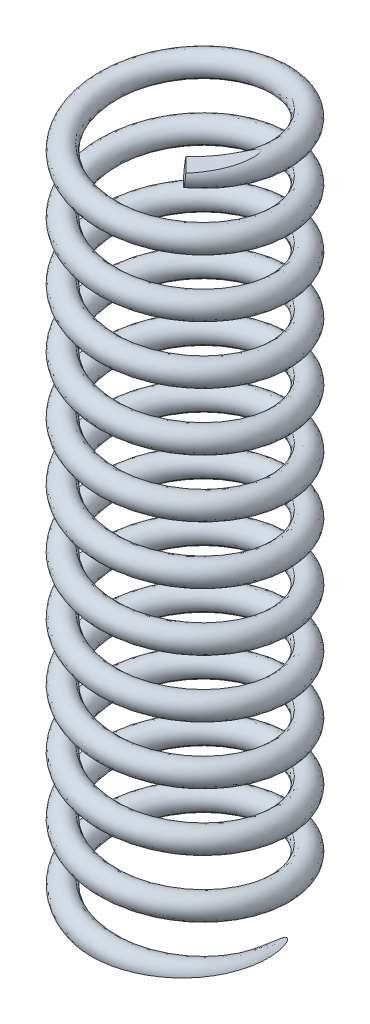
from build123d import *

# Parameters (mm, degrees)
WYCI_GNI_CIE_PO_CIE_CE1_PITCH       = 20
WYCI_GNI_CIE_PO_CIE_CE1_HEIGHT      = 330
WYCI_GNI_CIE_PO_CIE_CE1_RADIUS      = 30
WYCI_GNI_CIE_PO_CIE_CE1_START_ANGLE = -135
SZKIC3_R                            = 4
WYTNIJ_WYCI_GNI_CIE1_DEPTH          = 40
WYTNIJ_WYCI_GNI_CIE1_DEPTH_BACK     = 40
SZKIC4_W                            = 119.333488775
SZKIC4_H                            = 29.635807342
SZKIC4_W_2                          = 156.068337871
SZKIC4_H_2                          = 99.910466123


with BuildPart() as part:
    # Wyciągnięcie po ścieżce1: sweep along a helix
    with BuildLine() as wyci_gni_cie_po_cie_ce1_path:
        add(Helix(WYCI_GNI_CIE_PO_CIE_CE1_PITCH, WYCI_GNI_CIE_PO_CIE_CE1_HEIGHT, WYCI_GNI_CIE_PO_CIE_CE1_RADIUS, center=(0, 0, 0), direction=(0, 1, 0), lefthand=True, mode=Mode.PRIVATE).rotate(Axis((0, 0, 0), (0, 1, 0)), WYCI_GNI_CIE_PO_CIE_CE1_START_ANGLE))
    # Szkic3 → Wyciągnięcie po ścieżce1 (sweep)
    with BuildSketch(Plane(origin=(-21.213203436, 0, -21.213203436), x_dir=(-0.711031848696283, 0.10434289671480748, -0.6953749132983653), z_dir=(0.7031598041267334, 0.10551104075352287, -0.703159804126745))):
        Circle(SZKIC3_R)
    sweep(path=wyci_gni_cie_po_cie_ce1_path.line, is_frenet=True)

    # Szkic4 → Wytnij-wyciągnięcie1 (cut, two sides: drawn at the far end of the back side and taken through both)
    with BuildSketch(Plane.XY.offset(-WYTNIJ_WYCI_GNI_CIE1_DEPTH_BACK)):
        with Locations((11.351859688, 346.72600338)):
            Rectangle(SZKIC4_W, SZKIC4_H)
        with Locations((23.617921259, 40.952866648)):
            Rectangle(SZKIC4_W_2, SZKIC4_H_2)
    extrude(amount=WYTNIJ_WYCI_GNI_CIE1_DEPTH + WYTNIJ_WYCI_GNI_CIE1_DEPTH_BACK, mode=Mode.SUBTRACT)


solid = part.part
